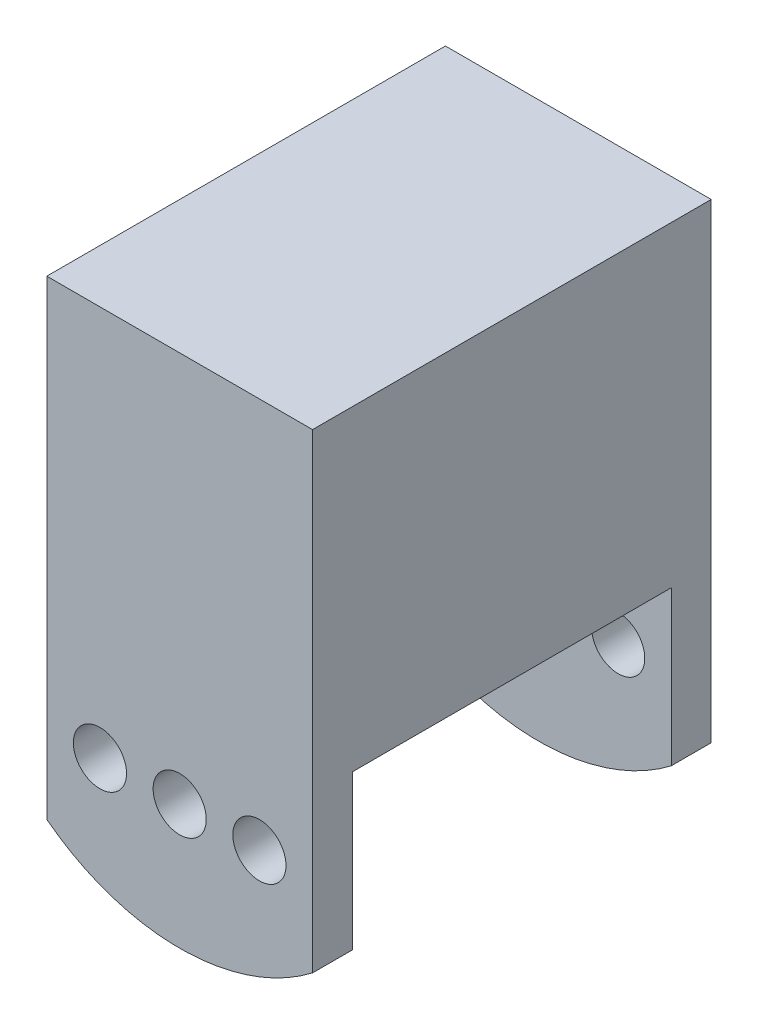
from build123d import *

# Parameters (mm, degrees)
SKETCH1_R           = 2
BOSS_EXTRUDE1_DEPTH = 30
SKETCH2_W           = 24
SKETCH2_H           = 15
CUT_EXTRUDE1_DEPTH  = 43.435404183
SKETCH3_R           = 8.9
SKETCH3_R_2         = 2
CUT_EXTRUDE2_DEPTH  = 3


with BuildPart() as part:
    # Sketch1 → Boss-Extrude1 (new body)
    with BuildSketch(Plane.XY):
        with BuildLine():
            Line((-10, 22.377746272), (10, 22.377746272))
            Line((10, 22.377746272), (10, -13.032253728))
            ThreePointArc((10, -13.032253728), (0, -16.426796317), (-10, -13.032253728))
            Line((-10, -13.032253728), (-10, 22.377746272))
        make_face()
        with Locations((0, -7.032253728)):
            Circle(SKETCH1_R, mode=Mode.SUBTRACT)
        with Locations((6, -7.032253728)):
            Circle(SKETCH1_R, mode=Mode.SUBTRACT)
        with Locations((-6, -7.032253728)):
            Circle(SKETCH1_R, mode=Mode.SUBTRACT)
    extrude(amount=BOSS_EXTRUDE1_DEPTH)

    # Sketch2 → Cut-Extrude1 (cut, through all)
    with BuildSketch(Plane(origin=(10, 0, 0), x_dir=(0, 0, -1), z_dir=(1, 0, 0))):
        with Locations((-15, -8.926796317)):
            Rectangle(SKETCH2_W, SKETCH2_H)
    extrude(amount=-CUT_EXTRUDE1_DEPTH, mode=Mode.SUBTRACT)

    # Sketch3 → Cut-Extrude2 (cut)
    with BuildSketch(Plane.ZY.offset(10)):
        with Locations((15, 10.473203683)):
            Circle(SKETCH3_R)
        with Locations((15, 16.473203683)):
            Circle(SKETCH3_R_2, mode=Mode.SUBTRACT)
        with Locations((15, 4.473203683)):
            Circle(SKETCH3_R_2, mode=Mode.SUBTRACT)
        with Locations((9, 10.473203683)):
            Circle(SKETCH3_R_2, mode=Mode.SUBTRACT)
        with Locations((21, 10.473203683)):
            Circle(SKETCH3_R_2, mode=Mode.SUBTRACT)
    extrude(amount=-CUT_EXTRUDE2_DEPTH, mode=Mode.SUBTRACT)


solid = part.part
